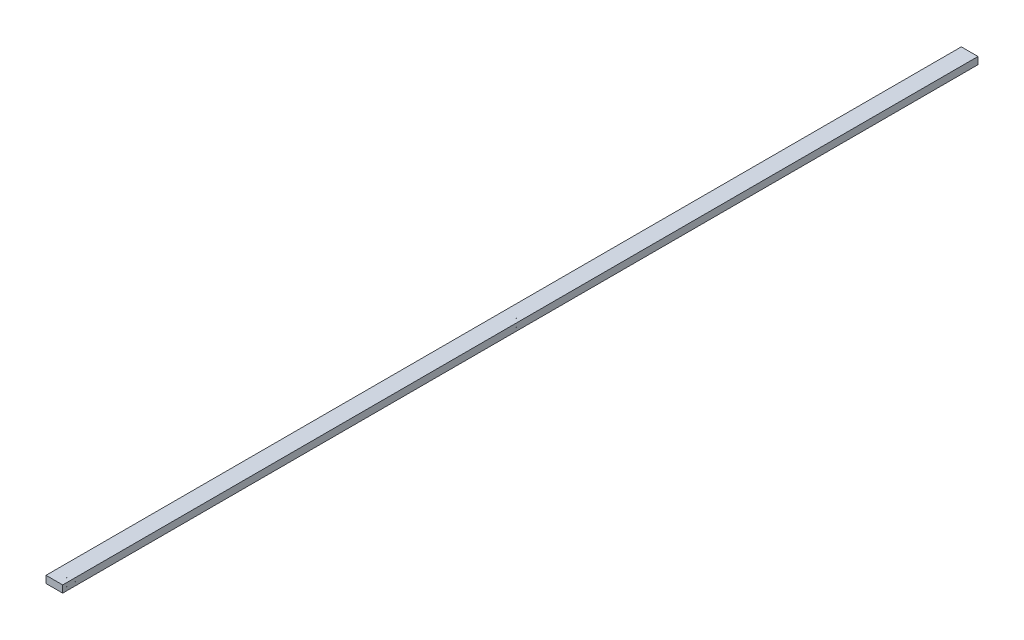
from build123d import *

# Parameters (mm, degrees)
SKETCH1_W           = 88.9
SKETCH1_H           = 38.1
BOSS_EXTRUDE1_DEPTH = 4876.8
SKETCH3_R           = 0.889
CUT_EXTRUDE2_DEPTH  = 38.1
SKETCH5_R           = 0.889
CUT_EXTRUDE3_DEPTH  = 88.9


with BuildPart() as part:
    # Sketch1 → Boss-Extrude1 (new body)
    with BuildSketch(Plane.XY):
        with Locations((44.45, 19.05)):
            Rectangle(SKETCH1_W, SKETCH1_H)
    extrude(amount=BOSS_EXTRUDE1_DEPTH)

    # Sketch3 → Cut-Extrude2 (cut)
    with BuildSketch(Plane.XZ):
        with Locations(Location((66.675, 4832.35, 0), (0, 0, 270))):
            Circle(SKETCH3_R)
        with Locations(Location((22.225, 4832.35, 0), (0, 0, 270))):
            Circle(SKETCH3_R)
        with Locations(Location((22.225, 2438.4, 0), (0, 0, 270))):
            Circle(SKETCH3_R)
        with Locations(Location((66.675, 2438.4, 0), (0, 0, 270))):
            Circle(SKETCH3_R)
        with Locations(Location((66.675, 44.45, 0), (0, 0, 270))):
            Circle(SKETCH3_R)
        with Locations(Location((22.225, 44.45, 0), (0, 0, 270))):
            Circle(SKETCH3_R)
    extrude(amount=-CUT_EXTRUDE2_DEPTH, mode=Mode.SUBTRACT)

    # Sketch5 → Cut-Extrude3 (cut)
    with BuildSketch(Plane(origin=(88.9, 0, 0), x_dir=(0, 0, -1), z_dir=(1, 0, 0))):
        with Locations((-4854.575, 19.05)):
            Circle(SKETCH5_R)
        with Locations((-4810.125, 19.05)):
            Circle(SKETCH5_R)
        with Locations((-2460.625, 19.05)):
            Circle(SKETCH5_R)
        with Locations((-2416.175, 19.05)):
            Circle(SKETCH5_R)
        with Locations((-22.225, 19.05)):
            Circle(SKETCH5_R)
        with Locations((-66.675, 19.05)):
            Circle(SKETCH5_R)
    extrude(amount=-CUT_EXTRUDE3_DEPTH, mode=Mode.SUBTRACT)


solid = part.part
